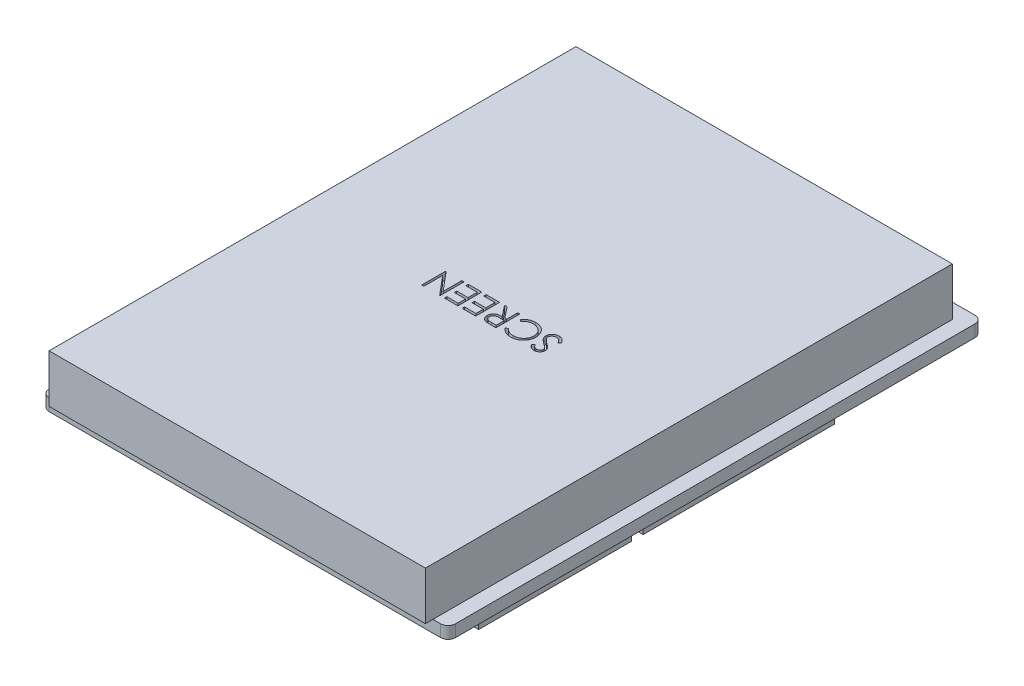
from build123d import *

# Parameters (mm, degrees)
SKETCH1_W           = 54
SKETCH1_H           = 71
BOSS_EXTRUDE1_DEPTH = 1.6
FILLET1_R           = 1
FILLET2_R           = 1
FILLET3_R           = 1
FILLET4_R           = 1
SKETCH2_W           = 50
SKETCH2_H           = 70
BOSS_EXTRUDE2_DEPTH = 6.4
CUT_EXTRUDE1_DEPTH  = 1
SKETCH4_W           = 2.54
SKETCH4_H           = 15.24
SKETCH4_H_2         = 20.32
SKETCH4_H_3         = 25.4
BOSS_EXTRUDE3_DEPTH = 2.54


with BuildPart() as part:
    # Sketch1 → Boss-Extrude1 (new body)
    with BuildSketch(Plane(origin=(0, 0, 0), x_dir=(1, 0, 0), z_dir=(0, 1, 0))):
        with Locations((14.638678906, 10.348475591)):
            Rectangle(SKETCH1_W, SKETCH1_H)
    extrude(amount=BOSS_EXTRUDE1_DEPTH)

    # Fillet1
    fillet1_edges = [part.edges().sort_by_distance(p)[0] for p in [
        (-12.361321094, 0.8, -45.848475591),
    ]]
    fillet(fillet1_edges, radius=FILLET1_R)

    # Fillet2
    fillet2_edges = [part.edges().sort_by_distance(p)[0] for p in [
        (41.638678906, 0.8, -45.848475591),
    ]]
    fillet(fillet2_edges, radius=FILLET2_R)

    # Fillet3
    fillet3_edges = [part.edges().sort_by_distance(p)[0] for p in [
        (41.638678906, 0.8, 25.151524409),
    ]]
    fillet(fillet3_edges, radius=FILLET3_R)

    # Fillet4
    fillet4_edges = [part.edges().sort_by_distance(p)[0] for p in [
        (-12.361321094, 0.8, 25.151524409),
    ]]
    fillet(fillet4_edges, radius=FILLET4_R)

    # Sketch2 → Boss-Extrude2 (add)
    with BuildSketch(Plane(origin=(0, 1.6, 0), x_dir=(1, 0, 0), z_dir=(0, 1, 0))):
        with Locations((14.638678906, 8.848475591)):
            Rectangle(SKETCH2_W, SKETCH2_H)
    extrude(amount=BOSS_EXTRUDE2_DEPTH)

    # Sketch3 → Cut-Extrude1 (cut)
    # profile 1 of 6: a face of its own
    with BuildSketch(Plane(origin=(0, 8, 0), x_dir=(1, 0, 0), z_dir=(0, 1, 0))):
        with BuildLine():
            Line((22.779704547, 8.735990615), (22.511305108, 8.575078155))
            add(Edge.make_bspline(
                [(22.511305108, 8.575078155), (22.464827377, 8.655763541), (22.391426698, 8.768913948), (22.276042247, 8.897048242), (22.189894257, 8.972262268), (22.100747489, 9.031370777), (21.978288004, 9.087106697), (21.879542463, 9.104416705), (21.814229787, 9.104244822)],
                knots=[0, 0, 0, 0, 0.3046461, 0.438546905, 0.562322299, 0.677432543, 0.786897393, 1, 1, 1, 1], degree=3))
            add(Edge.make_bspline(
                [(21.814229787, 9.104244822), (21.759096921, 9.104467093), (21.676511665, 9.095575041), (21.571184511, 9.063600754), (21.496058834, 9.03145894), (21.426441282, 8.991895046), (21.364423021, 8.945252325), (21.312026035, 8.891366853), (21.268692843, 8.832185632), (21.234824817, 8.768942047), (21.202480773, 8.681394924), (21.192169182, 8.612200222), (21.192204547, 8.566173908)],
                knots=[0, 0, 0, 0, 0.181010038, 0.27040523, 0.360512832, 0.448738091, 0.532675464, 0.614375665, 0.694558805, 0.772713677, 0.849122955, 1, 1, 1, 1], degree=3))
            add(Edge.make_bspline(
                [(21.192204547, 8.566173908), (21.191649651, 8.512498927), (21.214180144, 8.400585878), (21.27102148, 8.30187414), (21.306051702, 8.254525271)],
                knots=[0, 0, 0, 0, 0.475390581, 1, 1, 1, 1], degree=3))
            add(Edge.make_bspline(
                [(21.306051702, 8.254525271), (21.334971046, 8.215406841), (21.385741384, 8.158086186), (21.461340532, 8.082411338), (21.529173174, 8.020855597), (21.604727143, 7.955965528), (21.720924649, 7.863185394), (21.813482964, 7.794152936), (21.878467568, 7.748255239)],
                knots=[0, 0, 0, 0, 0.190099402, 0.299186879, 0.418361668, 0.548359268, 0.688774766, 1, 1, 1, 1], degree=3))
            add(Edge.make_bspline(
                [(21.878467568, 7.748255239), (21.942648106, 7.703211752), (22.032752204, 7.636719019), (22.144907337, 7.549451254), (22.215575753, 7.493659598), (22.275232911, 7.441660177), (22.337844156, 7.385921266), (22.376801725, 7.343452504), (22.398729987, 7.316399269)],
                knots=[0, 0, 0, 0, 0.347075306, 0.495558726, 0.629076644, 0.745524338, 0.845833579, 1, 1, 1, 1], degree=3))
            add(Edge.make_bspline(
                [(22.398729987, 7.316399269), (22.426768733, 7.280038839), (22.466008847, 7.224280257), (22.50757902, 7.14483975), (22.532345849, 7.084708849), (22.552336601, 7.023560745), (22.571023606, 6.940002278), (22.576388833, 6.875847334), (22.576178906, 6.833025872)],
                knots=[0, 0, 0, 0, 0.262550464, 0.388251856, 0.511530984, 0.633734148, 0.755401792, 1, 1, 1, 1], degree=3))
            add(Edge.make_bspline(
                [(22.576178906, 6.833025872), (22.576419585, 6.766544753), (22.563655547, 6.667836638), (22.521718021, 6.542966557), (22.476891342, 6.456196323), (22.421443243, 6.37572417), (22.355646595, 6.302976171), (22.278246844, 6.24046058), (22.192081737, 6.187305155), (22.098871662, 6.144944711), (21.967193943, 6.103232445), (21.863254226, 6.092773156), (21.793877223, 6.092065335)],
                knots=[0, 0, 0, 0, 0.165770437, 0.246265968, 0.327681675, 0.408711214, 0.489624888, 0.571614731, 0.656207004, 0.741698291, 0.826556649, 1, 1, 1, 1], degree=3))
            add(Edge.make_bspline(
                [(21.793877223, 6.092065335), (21.71962608, 6.091453096), (21.608539846, 6.1064513), (21.467255109, 6.154217882), (21.382487408, 6.196456122), (21.316120407, 6.238255442), (21.265561398, 6.276414748), (21.214048563, 6.320253789), (21.162133128, 6.370695365), (21.109317721, 6.426741396), (21.035783629, 6.512010414), (20.982530555, 6.580783147), (20.947973777, 6.62950023)],
                knots=[0, 0, 0, 0, 0.212612572, 0.318547415, 0.426488723, 0.483329676, 0.543275454, 0.607966231, 0.677191883, 0.750735922, 0.828747966, 1, 1, 1, 1], degree=3))
            Line((20.947973777, 6.62950023), (21.205560917, 6.824757642))
            add(Edge.make_bspline(
                [(21.205560917, 6.824757642), (21.235060396, 6.785800243), (21.279903323, 6.731254536), (21.339369977, 6.662693511), (21.381864055, 6.619879223), (21.420781745, 6.580473373), (21.4592229, 6.547333551), (21.495704943, 6.519411759), (21.541585225, 6.489568706), (21.599852161, 6.460734167), (21.697096845, 6.427239866), (21.774289641, 6.417850999), (21.825678104, 6.41770636)],
                knots=[0, 0, 0, 0, 0.189595982, 0.274136202, 0.352121651, 0.423699703, 0.489040362, 0.548952296, 0.601909863, 0.701279607, 0.80043443, 1, 1, 1, 1], degree=3))
            add(Edge.make_bspline(
                [(21.825678104, 6.41770636), (21.888905405, 6.416530536), (21.981209982, 6.430774966), (22.092473076, 6.479821834), (22.162021608, 6.531002211), (22.219367139, 6.592097691), (22.275915143, 6.685306315), (22.291111702, 6.766253308), (22.291243008, 6.819669501)],
                knots=[0, 0, 0, 0, 0.275822022, 0.401868693, 0.527874505, 0.650458955, 0.765963766, 1, 1, 1, 1], degree=3))
            add(Edge.make_bspline(
                [(22.291243008, 6.819669501), (22.291888072, 6.853949207), (22.285352875, 6.905042438), (22.266462408, 6.971285192), (22.246491976, 7.020870607), (22.219292744, 7.071552735), (22.167087338, 7.144466304), (22.117806658, 7.195523712), (22.081993209, 7.229900872)],
                knots=[0, 0, 0, 0, 0.216119916, 0.32340733, 0.434613213, 0.55329871, 0.68599313, 1, 1, 1, 1], degree=3))
            add(Edge.make_bspline(
                [(22.081993209, 7.229900872), (22.065675508, 7.244854998), (22.03583529, 7.26941918), (21.988475505, 7.304708878), (21.939988495, 7.341539748), (21.881955418, 7.384242568), (21.785787115, 7.452672653), (21.709554304, 7.50779052), (21.65522538, 7.546001633)],
                knots=[0, 0, 0, 0, 0.124951974, 0.218093899, 0.333502411, 0.468789179, 0.624937586, 1, 1, 1, 1], degree=3))
            add(Edge.make_bspline(
                [(21.65522538, 7.546001633), (21.588415567, 7.594401706), (21.491914917, 7.665364935), (21.37302272, 7.763925814), (21.295490129, 7.833205969), (21.225765019, 7.899916237), (21.164546454, 7.964803599), (21.11156276, 8.027443642), (21.053725407, 8.107205257), (20.99543586, 8.206076741), (20.929514013, 8.36449904), (20.907250572, 8.488896856), (20.907268649, 8.570626032)],
                knots=[0, 0, 0, 0, 0.187763162, 0.272381231, 0.35130177, 0.424311551, 0.491881862, 0.554202887, 0.610843189, 0.715917624, 0.814550236, 1, 1, 1, 1], degree=3))
            add(Edge.make_bspline(
                [(20.907268649, 8.570626032), (20.906401892, 8.627055411), (20.915574279, 8.710617195), (20.942573966, 8.818626272), (20.972243326, 8.895582943), (21.009393863, 8.969979078), (21.054607647, 9.041685994), (21.109406203, 9.109524974), (21.170279625, 9.174813674), (21.237894925, 9.233860638), (21.309445648, 9.28645358), (21.384530223, 9.33148216), (21.464006364, 9.366867312), (21.546563812, 9.395135972), (21.662789704, 9.422694146), (21.753303097, 9.430134536), (21.814229787, 9.429885847)],
                knots=[0, 0, 0, 0, 0.121779146, 0.180926421, 0.240265226, 0.299715473, 0.360502633, 0.423143728, 0.487999854, 0.553287074, 0.616916643, 0.679808819, 0.742177612, 0.804655804, 0.868253993, 1, 1, 1, 1], degree=3))
            add(Edge.make_bspline(
                [(21.814229787, 9.429885847), (21.861913459, 9.430091512), (21.932521457, 9.424579754), (22.025178102, 9.408622009), (22.092031726, 9.390655891), (22.157559594, 9.368310177), (22.221178759, 9.340960375), (22.283042456, 9.308398661), (22.343227181, 9.270577322), (22.40228372, 9.226978003), (22.459973955, 9.176638133), (22.516585799, 9.11979818), (22.572357942, 9.056538994), (22.625962399, 8.985807913), (22.698353993, 8.880248987), (22.747734187, 8.795085344), (22.779704547, 8.735990615)],
                knots=[0, 0, 0, 0, 0.113700276, 0.168685943, 0.22415832, 0.278721005, 0.333797387, 0.389246684, 0.445400209, 0.503284563, 0.564257591, 0.627941476, 0.694625909, 0.765364026, 0.839605496, 1, 1, 1, 1], degree=3))
        make_face()
    # profile 2 of 6: a face of its own
    with BuildSketch(Plane(origin=(0, 8, 0), x_dir=(1, 0, 0), z_dir=(0, 1, 0))):
        with BuildLine():
            Line((17.325217367, 6.756067739), (17.574536277, 6.946873027))
            add(Edge.make_bspline(
                [(17.574536277, 6.946873027), (17.60923806, 6.9042689), (17.664222267, 6.843290737), (17.743749275, 6.769068033), (17.805311764, 6.717074334), (17.870642783, 6.670578869), (17.93723266, 6.625943424), (18.007506363, 6.586866278), (18.104187759, 6.539118737), (18.231155654, 6.490448103), (18.44634878, 6.43348659), (18.614760254, 6.417237761), (18.728272255, 6.41770636)],
                knots=[0, 0, 0, 0, 0.125463758, 0.187104543, 0.248272217, 0.309267291, 0.370081569, 0.431199431, 0.492676566, 0.616182177, 0.740866795, 1, 1, 1, 1], degree=3))
            add(Edge.make_bspline(
                [(18.728272255, 6.41770636), (18.791658936, 6.416896506), (18.886003491, 6.423625536), (19.009933541, 6.442079296), (19.100464602, 6.461805926), (19.188893568, 6.487537252), (19.275894778, 6.517701264), (19.36044334, 6.555240663), (19.443556759, 6.596697146), (19.523181571, 6.643535381), (19.59853535, 6.694608305), (19.669278239, 6.749411447), (19.735590151, 6.807815282), (19.796802891, 6.870501639), (19.853566753, 6.936766198), (19.905809268, 7.006908215), (19.953476596, 7.080592546), (19.99611183, 7.157455218), (20.033084192, 7.237166055), (20.064334134, 7.3194206), (20.089695597, 7.404042354), (20.109508844, 7.490732588), (20.128149178, 7.61062383), (20.134641816, 7.702254595), (20.133871213, 7.764155679)],
                knots=[0, 0, 0, 0, 0.087505382, 0.130467856, 0.173045098, 0.215416262, 0.257664718, 0.30016934, 0.343139803, 0.385945193, 0.427707431, 0.468841302, 0.509516782, 0.549704096, 0.589802695, 0.62999428, 0.670459298, 0.71097624, 0.751343588, 0.791767231, 0.832452203, 0.873313967, 0.91453953, 1, 1, 1, 1], degree=3))
            add(Edge.make_bspline(
                [(20.133871213, 7.764155679), (20.134253649, 7.856307231), (20.12153252, 7.992470867), (20.079888874, 8.167613847), (20.034860144, 8.290619756), (19.978151914, 8.408229739), (19.907416164, 8.519018074), (19.82517645, 8.624607672), (19.730595052, 8.72244136), (19.626809814, 8.811805864), (19.515460669, 8.890502305), (19.396820444, 8.956098692), (19.272200248, 9.010699888), (19.140640907, 9.052611647), (18.953157509, 9.092929009), (18.807402473, 9.105040053), (18.708555709, 9.104244822)],
                knots=[0, 0, 0, 0, 0.126288634, 0.186724296, 0.246416816, 0.305583727, 0.365436773, 0.426332987, 0.488845857, 0.55173019, 0.613923091, 0.675487544, 0.737336955, 0.80023137, 0.864503875, 1, 1, 1, 1], degree=3))
            add(Edge.make_bspline(
                [(18.708555709, 9.104244822), (18.599540536, 9.104275054), (18.437614538, 9.088900034), (18.230881349, 9.032685802), (18.084538985, 8.974789333), (17.94548126, 8.89939086), (17.766251454, 8.775735836), (17.64775214, 8.659289422), (17.574536277, 8.575078155)],
                knots=[0, 0, 0, 0, 0.252948636, 0.374754734, 0.495939754, 0.617180641, 0.740909469, 1, 1, 1, 1], degree=3))
            Line((17.574536277, 8.575078155), (17.325217367, 8.763975391))
            add(Edge.make_bspline(
                [(17.325217367, 8.763975391), (17.364509703, 8.816165536), (17.426917735, 8.891204077), (17.518465475, 8.982781789), (17.590471687, 9.046497334), (17.666287793, 9.105776059), (17.745856241, 9.160360068), (17.828786723, 9.210850071), (17.915181316, 9.256613613), (18.005045221, 9.297335335), (18.097608212, 9.332926488), (18.193039818, 9.362810469), (18.290587719, 9.387925454), (18.391253282, 9.405839271), (18.529604305, 9.425178434), (18.635527304, 9.430018985), (18.706647656, 9.429885847)],
                knots=[0, 0, 0, 0, 0.123064642, 0.183492267, 0.243749436, 0.304060834, 0.36465054, 0.425397956, 0.486848765, 0.548683737, 0.611128201, 0.673519014, 0.73695791, 0.800713999, 0.865999987, 1, 1, 1, 1], degree=3))
            add(Edge.make_bspline(
                [(18.706647656, 9.429885847), (18.774198239, 9.430727833), (18.874060327, 9.425310692), (19.005067936, 9.411158729), (19.099206863, 9.395544748), (19.190942434, 9.377082947), (19.279443858, 9.352345734), (19.365581783, 9.324632822), (19.449010233, 9.292062009), (19.529800015, 9.255307936), (19.607691084, 9.21376874), (19.682645663, 9.167791999), (19.755407961, 9.11839743), (19.824875966, 9.063974824), (19.914566972, 8.985377301), (19.977127785, 8.920589922), (20.016207952, 8.874642458)],
                knots=[0, 0, 0, 0, 0.137749562, 0.203916744, 0.268779862, 0.332413706, 0.39475354, 0.456180032, 0.516995649, 0.577395938, 0.637198344, 0.696999184, 0.756756194, 0.816553905, 0.876947997, 1, 1, 1, 1], degree=3))
            add(Edge.make_bspline(
                [(20.016207952, 8.874642458), (20.081975186, 8.79776043), (20.170493863, 8.674617611), (20.263780355, 8.496609888), (20.320878466, 8.357644625), (20.364636904, 8.212322264), (20.406545379, 8.007656932), (20.419088001, 7.849419261), (20.418807111, 7.74253108)],
                knots=[0, 0, 0, 0, 0.247151992, 0.368773744, 0.490246535, 0.613620064, 0.738961826, 1, 1, 1, 1], degree=3))
            add(Edge.make_bspline(
                [(20.418807111, 7.74253108), (20.418769689, 7.630260598), (20.404808857, 7.46369605), (20.352818841, 7.250352379), (20.300202567, 7.099103307), (20.23070327, 6.955253178), (20.146589758, 6.818197066), (20.047017488, 6.688046207), (19.933243221, 6.566464671), (19.808443347, 6.455307196), (19.674805857, 6.357509833), (19.532581847, 6.276126979), (19.383340507, 6.208081403), (19.225965197, 6.155840062), (19.002287547, 6.106006912), (18.828213878, 6.092294108), (18.710463761, 6.092065335)],
                knots=[0, 0, 0, 0, 0.127010561, 0.187950414, 0.247928144, 0.307763872, 0.36824929, 0.429483187, 0.4927553, 0.556268147, 0.618225714, 0.679662968, 0.741251597, 0.803419862, 0.866818576, 1, 1, 1, 1], degree=3))
            add(Edge.make_bspline(
                [(18.710463761, 6.092065335), (18.638274947, 6.091929257), (18.531118011, 6.096829731), (18.390960727, 6.115901235), (18.289502204, 6.135064778), (18.190411316, 6.158930085), (18.09413401, 6.188804772), (18.000945988, 6.224927247), (17.910218902, 6.265130161), (17.823116104, 6.31117353), (17.739680584, 6.361220407), (17.660591077, 6.416235305), (17.585328809, 6.475413126), (17.514259011, 6.539219244), (17.423358906, 6.629204742), (17.363483792, 6.704597318), (17.325217367, 6.756067739)],
                knots=[0, 0, 0, 0, 0.135658967, 0.20117943, 0.265635283, 0.329595613, 0.392593515, 0.454884677, 0.517294186, 0.578946473, 0.63988553, 0.699998728, 0.75984869, 0.819660195, 0.879376112, 1, 1, 1, 1], degree=3))
        make_face()
    # profile 3 of 6: a face of its own
    with BuildSketch(Plane(origin=(0, 8, 0), x_dir=(1, 0, 0), z_dir=(0, 1, 0))):
        with BuildLine():
            Line((16.673935316, 6.173475591), (16.038553705, 6.173475591))
            add(Edge.make_bspline(
                [(16.038553705, 6.173475591), (15.957155297, 6.17393901), (15.840472005, 6.173680655), (15.692125441, 6.1797294), (15.596856065, 6.183451556), (15.512305673, 6.190271307), (15.420540008, 6.198222547), (15.357405518, 6.208180507), (15.319217768, 6.21672479)],
                knots=[0, 0, 0, 0, 0.338434414, 0.484822051, 0.617157578, 0.734698361, 0.837385184, 1, 1, 1, 1], degree=3))
            add(Edge.make_bspline(
                [(15.319217768, 6.21672479), (15.272965311, 6.226876037), (15.205736596, 6.248092546), (15.120779213, 6.285591178), (15.061014271, 6.318400834), (15.004593301, 6.355776984), (14.951512848, 6.397831869), (14.902487065, 6.444935978), (14.855770988, 6.495135376), (14.814979089, 6.550616421), (14.778255082, 6.608563405), (14.747428258, 6.670091984), (14.723164551, 6.734891889), (14.702848288, 6.802327164), (14.68423777, 6.89809229), (14.679152202, 6.972348637), (14.679384034, 7.022559125)],
                knots=[0, 0, 0, 0, 0.12703991, 0.188709102, 0.249085329, 0.309868062, 0.370230871, 0.430628561, 0.492276732, 0.55409549, 0.615218447, 0.676314893, 0.738476023, 0.800795937, 0.865209823, 1, 1, 1, 1], degree=3))
            add(Edge.make_bspline(
                [(14.679384034, 7.022559125), (14.679094088, 7.10494795), (14.693125951, 7.227252373), (14.747314269, 7.378964003), (14.80198726, 7.482513623), (14.871664105, 7.575902991), (14.955378235, 7.657651562), (15.052725764, 7.726692191), (15.143774104, 7.774060113), (15.224239877, 7.804538624), (15.290678714, 7.826091236), (15.363207289, 7.842461847), (15.440785095, 7.857343313), (15.524011193, 7.868687712), (15.645879773, 7.879819496), (15.74042612, 7.882901194), (15.805135236, 7.883090976)],
                knots=[0, 0, 0, 0, 0.153710705, 0.226698871, 0.29917182, 0.371165996, 0.44297777, 0.516334013, 0.592857108, 0.63351018, 0.676623617, 0.722915422, 0.771971354, 0.823829257, 0.87938645, 1, 1, 1, 1], degree=3))
            Line((15.805135236, 7.883090976), (14.638678906, 9.348475591))
            Line((14.638678906, 9.348475591), (14.991032672, 9.348475591))
            Line((14.991032672, 9.348475591), (16.157489002, 7.883090976))
            Line((16.157489002, 7.883090976), (16.388999418, 7.883090976))
            Line((16.388999418, 7.883090976), (16.388999418, 9.348475591))
            Line((16.388999418, 9.348475591), (16.673935316, 9.348475591))
            Line((16.673935316, 9.348475591), (16.673935316, 6.173475591))
        make_face()
        with BuildLine():
            Line((16.388999418, 6.499116617), (16.388999418, 7.55744995))
            Line((16.388999418, 7.55744995), (15.807679306, 7.561902073))
            add(Edge.make_bspline(
                [(15.807679306, 7.561902073), (15.755057587, 7.562747185), (15.678911745, 7.559955283), (15.580953176, 7.554182599), (15.515602236, 7.547890643), (15.455734958, 7.539766584), (15.401390556, 7.529593245), (15.352449029, 7.517789999), (15.295550591, 7.499335025), (15.231284033, 7.47135708), (15.162879558, 7.427974914), (15.103066606, 7.375510465), (15.053321125, 7.31475983), (15.013429775, 7.247677191), (14.975905918, 7.151120473), (14.963812121, 7.073864458), (14.964319931, 7.021923107)],
                knots=[0, 0, 0, 0, 0.138878011, 0.201133482, 0.259058627, 0.312175748, 0.360589919, 0.404983277, 0.444988631, 0.518418117, 0.589382616, 0.65799459, 0.727585942, 0.795840798, 0.863196901, 1, 1, 1, 1], degree=3))
            add(Edge.make_bspline(
                [(14.964319931, 7.021923107), (14.96428567, 6.971380543), (14.975372646, 6.895513483), (15.014488902, 6.801568016), (15.054272404, 6.735879753), (15.103857643, 6.676692085), (15.161595374, 6.626205334), (15.226146861, 6.584262275), (15.285989243, 6.556588159), (15.339868694, 6.540304681), (15.386433728, 6.528484454), (15.439506971, 6.520206398), (15.498463771, 6.512591444), (15.563563009, 6.506148489), (15.662573297, 6.50017556), (15.740037239, 6.498930135), (15.793686918, 6.499116617)],
                knots=[0, 0, 0, 0, 0.136311338, 0.203719134, 0.273224715, 0.34260796, 0.411061944, 0.479238515, 0.549585203, 0.587913733, 0.630891961, 0.67900679, 0.732608365, 0.791193356, 0.855339952, 1, 1, 1, 1], degree=3))
            Line((15.793686918, 6.499116617), (16.388999418, 6.499116617))
        make_face(mode=Mode.SUBTRACT)
    # profile 4 of 6: a face of its own
    with BuildSketch(Plane(origin=(0, 8, 0), x_dir=(1, 0, 0), z_dir=(0, 1, 0))):
        Polygon((13.987396854, 6.173475591), (12.196371213, 6.173475591), (12.196371213, 6.499116617), (13.702460957, 6.499116617), (13.702460957, 7.476039694), (12.196371213, 7.476039694), (12.196371213, 7.801680719), (13.702460957, 7.801680719), (13.702460957, 9.022834565), (12.196371213, 9.022834565), (12.196371213, 9.348475591), (13.987396854, 9.348475591), align=None)
    # profile 5 of 6: a face of its own
    with BuildSketch(Plane(origin=(0, 8, 0), x_dir=(1, 0, 0), z_dir=(0, 1, 0))):
        Polygon((11.626499418, 6.173475591), (9.835473777, 6.173475591), (9.835473777, 6.499116617), (11.341563521, 6.499116617), (11.341563521, 7.476039694), (9.835473777, 7.476039694), (9.835473777, 7.801680719), (11.341563521, 7.801680719), (11.341563521, 9.022834565), (9.835473777, 9.022834565), (9.835473777, 9.348475591), (11.626499418, 9.348475591), align=None)
    # profile 6 of 6: a face of its own
    with BuildSketch(Plane(origin=(0, 8, 0), x_dir=(1, 0, 0), z_dir=(0, 1, 0))):
        Polygon((9.265601983, 9.348475591), (9.265601983, 6.173475591), (9.205816326, 6.173475591), (7.108230188, 8.672388852), (7.108230188, 6.173475591), (6.82329429, 6.173475591), (6.82329429, 9.348475591), (6.888168088, 9.348475591), (8.980666085, 6.855286489), (8.980666085, 9.348475591), align=None)
    extrude(amount=-CUT_EXTRUDE1_DEPTH, mode=Mode.SUBTRACT)

    # Sketch4 → Boss-Extrude3 (add)
    with BuildSketch(Plane.XZ):
        with Locations((-9.821321094, 11.531524409)):
            Rectangle(SKETCH4_W, SKETCH4_H)
        with Locations((-9.821321094, -8.788475591)):
            Rectangle(SKETCH4_W, SKETCH4_H_2)
        with Locations((38.438678906, -15.392475591)):
            Rectangle(SKETCH4_W, SKETCH4_H_3)
        with Locations((38.438678906, 8.991524409)):
            Rectangle(SKETCH4_W, SKETCH4_H_2)
    extrude(amount=BOSS_EXTRUDE3_DEPTH)


solid = part.part
